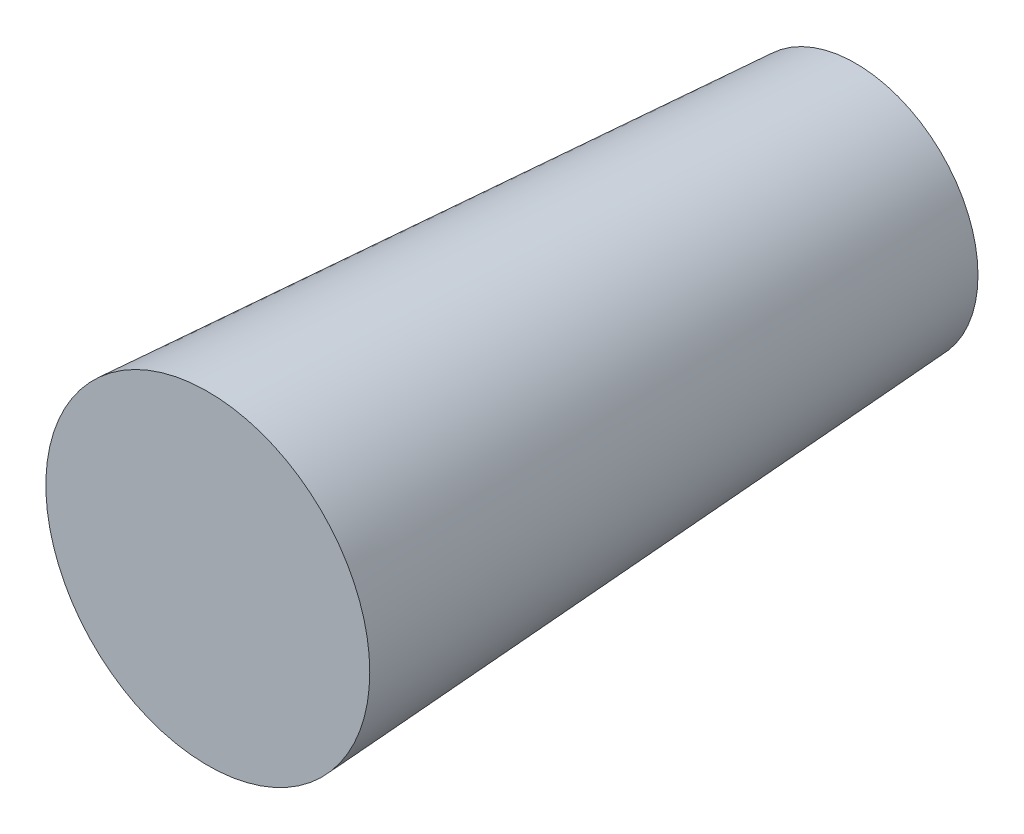
from build123d import *

# Parameters (mm, degrees)
SKETCH2_R = 4.5
SKETCH1_R = 3.4


with BuildPart() as part:
    # Sketch2 → Loft1 section 0
    with BuildSketch(Plane.XY.offset(18)):
        Circle(SKETCH2_R)
    # Sketch1 → Loft1 section 1
    with BuildSketch(Plane.XY):
        Circle(SKETCH1_R)
    loft()


solid = part.part
